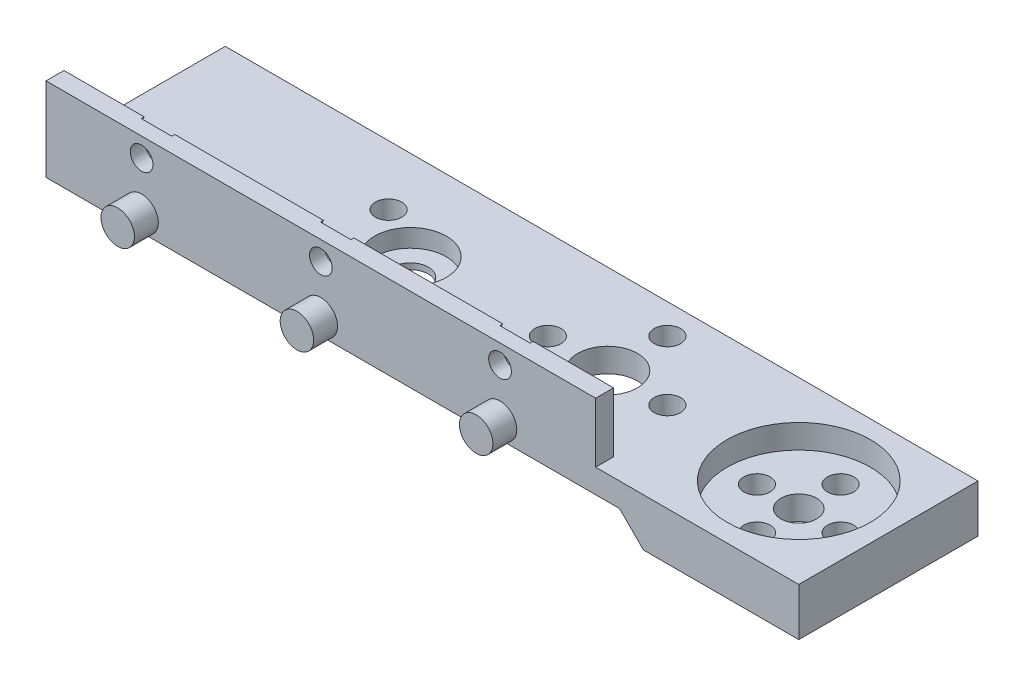
from build123d import *

# Parameters (mm, degrees)
SKETCH_1_W          = 48
SKETCH_1_H          = 15
SKETCH_1_R          = 1.1
SKETCH_1_R_2        = 1.5
SKETCH_1_R_3        = 2.5
EXTRUDE_1_DEPTH     = 2
EXTRUDE_2_DEPTH     = 2
SKETCH_4_R          = 3
CUT_EXTRUDE_1_DEPTH = 1.5
SKETCH_5_W          = 46
SKETCH_5_H          = 1.5
EXTRUDE_3_DEPTH     = 5
SKETCH_2_3_R        = 0.95
CUT_EXTRUDE_2_DEPTH = 6
CUT_EXTRUDE_START   = -0.25
SKETCH_7_R          = 0.95
CUT_EXTRUDE_3_DEPTH = 0.25
SKETCH_1_3_W        = 15
SKETCH_1_3_H        = 15
SKETCH_1_3_R        = 6
SKETCH_1_3_R_2      = 1.5
SKETCH_1_3_R_3      = 1.1
EXTRUDE_4_DEPTH     = 2
EXTRUDE_START       = -2
SKETCH_1_4_W        = 15
SKETCH_1_4_H        = 15
SKETCH_1_4_R        = 6
SKETCH_1_4_R_2      = 1.5
SKETCH_1_4_R_3      = 1.1
EXTRUDE_5_DEPTH     = 2
SKETCH_1_5_R        = 6
CUT_EXTRUDE_4_DEPTH = 2
CUT_EXTRUDE_5_DEPTH = 15


with BuildPart() as part:
    # 草图1 → 凸台-拉伸1 (new body)
    with BuildSketch(Plane(origin=(0, 0, 0), x_dir=(1, 0, 0), z_dir=(0, 1, 0))):
        with Locations((-7.5, 0)):
            Rectangle(SKETCH_1_W, SKETCH_1_H)
        with Locations(Location((-4.169872981, -2.5, 0), (0, 0, 270))):
            Circle(SKETCH_1_R, mode=Mode.SUBTRACT)
        with Locations(Location((3, 0, 0), (0, 0, 270))):
            Circle(SKETCH_1_R, mode=Mode.SUBTRACT)
        with Locations(Location((-8.5, 0, 0), (0, 0, 270))):
            Circle(SKETCH_1_R_2, mode=Mode.SUBTRACT)
        with Locations(Location((-12.830127019, 2.5, 0), (0, 0, 270))):
            Circle(SKETCH_1_R, mode=Mode.SUBTRACT)
        with Locations(Location((8, 0, 0), (0, 0, 270))):
            Circle(SKETCH_1_R_3, mode=Mode.SUBTRACT)
        with Locations(Location((13, 0, 0), (0, 0, 270))):
            Circle(SKETCH_1_R, mode=Mode.SUBTRACT)
        with Locations(Location((8, 5, 0), (0, 0, 270))):
            Circle(SKETCH_1_R, mode=Mode.SUBTRACT)
    extrude(amount=EXTRUDE_1_DEPTH)

    # 草图2 → 凸台-拉伸2 (add)
    with BuildSketch(Plane.XY.offset(7.5)):
        with BuildLine():
            Line((-22.1, 1.4), (-24.9, 1.4))
            ThreePointArc((-24.9, 1.4), (-23.5, 0), (-22.1, 1.4))
        make_face()
        with BuildLine():
            ThreePointArc((-24.764911064, 2), (-24.865810289, 1.707509764), (-24.9, 1.4))
            Line((-24.9, 1.4), (-22.1, 1.4))
            ThreePointArc((-22.1, 1.4), (-22.134189711, 1.707509764), (-22.235088936, 2))
            Line((-22.235088936, 2), (-24.764911064, 2))
        make_face()
        with BuildLine():
            ThreePointArc((-22.235088936, 2), (-23.5, 2.8), (-24.764911064, 2))
            Line((-24.764911064, 2), (-22.235088936, 2))
        make_face()
        with BuildLine():
            Line((-7.1, 1.4), (-9.9, 1.4))
            ThreePointArc((-9.9, 1.4), (-8.5, 0), (-7.1, 1.4))
        make_face()
        with BuildLine():
            ThreePointArc((-9.764911064, 2), (-9.865810289, 1.707509764), (-9.9, 1.4))
            Line((-9.9, 1.4), (-7.1, 1.4))
            ThreePointArc((-7.1, 1.4), (-7.134189711, 1.707509764), (-7.235088936, 2))
            Line((-7.235088936, 2), (-9.764911064, 2))
        make_face()
        with BuildLine():
            ThreePointArc((-7.235088936, 2), (-8.5, 2.8), (-9.764911064, 2))
            Line((-9.764911064, 2), (-7.235088936, 2))
        make_face()
        with BuildLine():
            Line((7.9, 1.4), (5.1, 1.4))
            ThreePointArc((5.1, 1.4), (6.5, 0), (7.9, 1.4))
        make_face()
        with BuildLine():
            ThreePointArc((5.235088936, 2), (5.134189711, 1.707509764), (5.1, 1.4))
            Line((5.1, 1.4), (7.9, 1.4))
            ThreePointArc((7.9, 1.4), (7.865810289, 1.707509764), (7.764911064, 2))
            Line((7.764911064, 2), (5.235088936, 2))
        make_face()
        with BuildLine():
            ThreePointArc((7.764911064, 2), (6.5, 2.8), (5.235088936, 2))
            Line((5.235088936, 2), (7.764911064, 2))
        make_face()
    extrude(amount=EXTRUDE_2_DEPTH)

    # 草图4 → 切除-拉伸1 (cut)
    with BuildSketch(Plane(origin=(0, 2, 0), x_dir=(1, 0, 0), z_dir=(0, 1, 0))):
        with Locations(Location((-8.5, 0, 0), (0, 0, 270))):
            Circle(SKETCH_4_R)
    extrude(amount=-CUT_EXTRUDE_1_DEPTH, mode=Mode.SUBTRACT)

    # 草图5 → 凸台-拉伸3 (add)
    with BuildSketch(Plane(origin=(0, 2, 0), x_dir=(1, 0, 0), z_dir=(0, 1, 0))):
        with Locations((-8.5, -6.75)):
            Rectangle(SKETCH_5_W, SKETCH_5_H)
    extrude(amount=EXTRUDE_3_DEPTH)

    # 草图2<3> → 切除-拉伸2 (cut)
    with BuildSketch(Plane.XY.offset(7.5)):
        with Locations((-23.5, 5.4)):
            Circle(SKETCH_2_3_R)
        with Locations((-8.5, 5.4)):
            Circle(SKETCH_2_3_R)
        with Locations((6.5, 5.4)):
            Circle(SKETCH_2_3_R)
    extrude(amount=-CUT_EXTRUDE_2_DEPTH, mode=Mode.SUBTRACT)

    # 草图7 → 切除-拉伸3 (cut)
    # profile 1 of 3: a face of its own
    with BuildSketch(Plane(origin=(0, 0, 6), x_dir=(-1, 0, 0), z_dir=(0, 0, -1)).offset(CUT_EXTRUDE_START)):
        Polygon((-7.596965511, 3.5), (-5.403034489, 3.5), (-4.306068977, 5.4), (-5.403034489, 7.3), (-7.596965511, 7.3), (-8.693931023, 5.4), align=None)
        with Locations(Location((-6.5, 5.4, 0), (0, 0, 180))):
            Circle(SKETCH_7_R, mode=Mode.SUBTRACT)
    # profile 2 of 3: a face of its own
    with BuildSketch(Plane(origin=(0, 0, 6), x_dir=(-1, 0, 0), z_dir=(0, 0, -1)).offset(CUT_EXTRUDE_START)):
        Polygon((6.306068977, 5.4), (7.403034489, 3.5), (9.596965511, 3.5), (10.693931023, 5.4), (9.596965511, 7.3), (7.403034489, 7.3), align=None)
        with Locations(Location((8.5, 5.4, 0), (0, 0, 180))):
            Circle(SKETCH_7_R, mode=Mode.SUBTRACT)
    # profile 3 of 3: a face of its own
    with BuildSketch(Plane(origin=(0, 0, 6), x_dir=(-1, 0, 0), z_dir=(0, 0, -1)).offset(CUT_EXTRUDE_START)):
        Polygon((21.306068977, 5.4), (22.403034489, 3.5), (24.596965511, 3.5), (25.693931023, 5.4), (24.596965511, 7.3), (22.403034489, 7.3), align=None)
    extrude(amount=CUT_EXTRUDE_3_DEPTH, mode=Mode.SUBTRACT)

    # 草图1<3> → 凸台-拉伸4 (add)
    # profile 1 of 2: a face of its own
    with BuildSketch(Plane(origin=(0, 0, 0), x_dir=(1, 0, 0), z_dir=(0, 1, 0))):
        with Locations((24, 0)):
            Rectangle(SKETCH_1_3_W, SKETCH_1_3_H)
        with Locations((24, 0)):
            Circle(SKETCH_1_3_R, mode=Mode.SUBTRACT)
    # profile 2 of 2: a face of its own
    with BuildSketch(Plane(origin=(0, 0, 0), x_dir=(1, 0, 0), z_dir=(0, 1, 0))):
        with Locations((24, 0)):
            Circle(SKETCH_1_3_R)
        with Locations(Location((24, 0, 0), (0, 0, 270))):
            Circle(SKETCH_1_3_R_2, mode=Mode.SUBTRACT)
        with Locations(Location((27.5, 0, 0), (0, 0, 270))):
            Circle(SKETCH_1_3_R_3, mode=Mode.SUBTRACT)
        with Locations(Location((24, -3.5, 0), (0, 0, 270))):
            Circle(SKETCH_1_3_R_3, mode=Mode.SUBTRACT)
        with Locations(Location((20.5, 0, 0), (0, 0, 270))):
            Circle(SKETCH_1_3_R_3, mode=Mode.SUBTRACT)
        with Locations(Location((24, 3.5, 0), (0, 0, 270))):
            Circle(SKETCH_1_3_R_3, mode=Mode.SUBTRACT)
    extrude(amount=EXTRUDE_4_DEPTH)

    # 草图1<4> → 凸台-拉伸5 (add)
    # profile 1 of 2: a face of its own
    with BuildSketch(Plane(origin=(0, 0, 0), x_dir=(1, 0, 0), z_dir=(0, 1, 0)).offset(EXTRUDE_START)):
        with Locations((24, 0)):
            Rectangle(SKETCH_1_4_W, SKETCH_1_4_H)
        with Locations((24, 0)):
            Circle(SKETCH_1_4_R, mode=Mode.SUBTRACT)
    # profile 2 of 2: a face of its own
    with BuildSketch(Plane(origin=(0, 0, 0), x_dir=(1, 0, 0), z_dir=(0, 1, 0)).offset(EXTRUDE_START)):
        with Locations((24, 0)):
            Circle(SKETCH_1_4_R)
        with Locations(Location((24, 0, 0), (0, 0, 270))):
            Circle(SKETCH_1_4_R_2, mode=Mode.SUBTRACT)
        with Locations(Location((27.5, 0, 0), (0, 0, 270))):
            Circle(SKETCH_1_4_R_3, mode=Mode.SUBTRACT)
        with Locations(Location((24, -3.5, 0), (0, 0, 270))):
            Circle(SKETCH_1_4_R_3, mode=Mode.SUBTRACT)
        with Locations(Location((20.5, 0, 0), (0, 0, 270))):
            Circle(SKETCH_1_4_R_3, mode=Mode.SUBTRACT)
        with Locations(Location((24, 3.5, 0), (0, 0, 270))):
            Circle(SKETCH_1_4_R_3, mode=Mode.SUBTRACT)
    extrude(amount=EXTRUDE_5_DEPTH)

    # 草图1<5> → 切除-拉伸4 (cut)
    with BuildSketch(Plane(origin=(0, 0, 0), x_dir=(1, 0, 0), z_dir=(0, 1, 0))):
        with Locations(Location((24, 0, 0), (0, 0, 270))):
            Circle(SKETCH_1_5_R)
    extrude(amount=CUT_EXTRUDE_4_DEPTH, mode=Mode.SUBTRACT)

    # 草图8 → 切除-拉伸5 (cut)
    with BuildSketch(Plane(origin=(0, 0, -7.5), x_dir=(-1, 0, 0), z_dir=(0, 0, -1))):
        Polygon((-16.5, 0), (-18.5, -2), (-16.5, -2), align=None)
    extrude(amount=-CUT_EXTRUDE_5_DEPTH, mode=Mode.SUBTRACT)


solid = part.part
